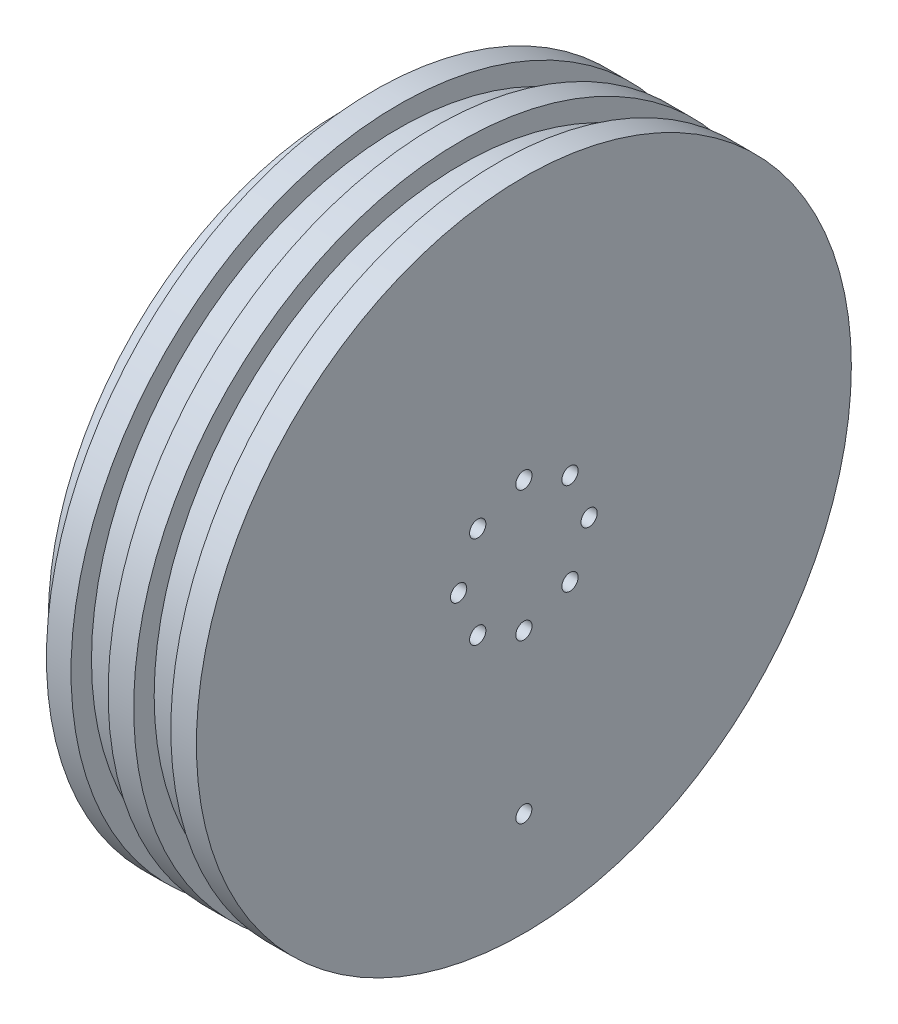
from build123d import *

# Parameters (mm, degrees)
CIRPATTERN2_COUNT              = 3
F_50_0_07_DIAMETER_HOLE1_D     = 1.778
F_50_0_07_DIAMETER_HOLE1_DEPTH = 11.938
F_50_0_07_DIAMETER_HOLE1_TIP   = 0.53416509
SKETCH60_R                     = 4.7625
BOSS_EXTRUDE4_DEPTH            = 5.461
CUT_EXTRUDE1_REACH             = 51.399
SKETCH54_R                     = 0.80645
F_1_16_0_0625_DIAMETER_HOLE1_D = 1.5875
Q_0_332_DIAMETER_HOLE2_D       = 8.4328
Q_0_332_DIAMETER_HOLE2_DEPTH   = 8.89
Q_0_332_DIAMETER_HOLE2_TIP     = 2.533468714


with BuildPart() as part:
    # Sketch1 → Revolve1 (revolve)
    with BuildSketch(Plane.XY, mode=Mode.PRIVATE) as revolve1_sk:
        Polygon((-12.599, 0), (0, 0), (0, 32.512), (-2.54, 32.512), (-2.54, 30.48), (-6.223, 30.48), (-6.223, 32.512), (-8.763, 32.512), (-8.763, 30.48), (-12.446, 30.48), (-12.446, 32.512), (-14.885, 32.512), (-14.885, 29.1592), (-18.06, 29.1592), (-18.06, 4.7625), (-12.599, 4.7625), align=None)
    revolve(revolve1_sk.sketch.rotate(Axis((17.779879847, 0, 0), (-1, 0, 0)), 90), axis=Axis((17.779879847, 0, 0), (-1, 0, 0)))

    # Sketch24 → #20 (0.161) Diameter Hole1 (revolve, cut)
    with BuildSketch(Plane(origin=(-18.06, 20.6375, 0), x_dir=(0, 0, 1), z_dir=(0, 1, 0))):
        Polygon((0, 0), (0, 10.880579708), (2.0447, 9.652), (2.0447, 0), align=None)
    f_20_0_161_diameter_hole1 = revolve(axis=Axis((-24.41, 20.6375, 0), (1, 0, 0)), mode=Mode.SUBTRACT)

    # CirPattern2: #20 (0.161) Diameter Hole1 ×3 about axis
    cirpattern2_axis = Axis((0, 0, 0), (1, 0, 0))
    for i in range(1, CIRPATTERN2_COUNT):
        add(f_20_0_161_diameter_hole1.rotate(cirpattern2_axis, i * 360 / CIRPATTERN2_COUNT), mode=Mode.SUBTRACT)

    # #50 (0.07) Diameter Hole1
    with Locations(Plane.ZY.offset(18.06)):
        with Locations((17.872599271, 10.31875)):
            Hole(F_50_0_07_DIAMETER_HOLE1_D / 2, depth=F_50_0_07_DIAMETER_HOLE1_DEPTH)
            with Locations((0, 0, -(F_50_0_07_DIAMETER_HOLE1_DEPTH + F_50_0_07_DIAMETER_HOLE1_TIP / 2))):  # 118° drill point
                Cone(0, F_50_0_07_DIAMETER_HOLE1_D / 2, F_50_0_07_DIAMETER_HOLE1_TIP, mode=Mode.SUBTRACT)

    # Sketch60 → Boss-Extrude4 (add)
    with BuildSketch(Plane.ZY.offset(12.599)):
        Circle(SKETCH60_R)
    extrude(amount=BOSS_EXTRUDE4_DEPTH)

    # Sketch54 → Cut-Extrude1 (cut, up to next)
    with BuildSketch(Plane(origin=(0, 0, 0), x_dir=(0, 0, -1), z_dir=(1, 0, 0)), mode=Mode.PRIVATE) as cut_extrude1_sk1:
        with Locations((0, 6.477)):
            Circle(SKETCH54_R)
    cut_extrude1_tool1 = extrude(cut_extrude1_sk1.sketch, amount=-CUT_EXTRUDE1_REACH, mode=Mode.PRIVATE) & part.part
    # Sketch54 → Cut-Extrude1 (cut, up to next)
    with BuildSketch(Plane(origin=(0, 0, 0), x_dir=(0, 0, -1), z_dir=(1, 0, 0)), mode=Mode.PRIVATE) as cut_extrude1_sk2:
        with Locations((4.579930622, 4.579930622)):
            Circle(SKETCH54_R)
    cut_extrude1_tool2 = extrude(cut_extrude1_sk2.sketch, amount=-CUT_EXTRUDE1_REACH, mode=Mode.PRIVATE) & part.part
    # Sketch54 → Cut-Extrude1 (cut, up to next)
    with BuildSketch(Plane(origin=(0, 0, 0), x_dir=(0, 0, -1), z_dir=(1, 0, 0)), mode=Mode.PRIVATE) as cut_extrude1_sk3:
        with Locations((6.477, 0)):
            Circle(SKETCH54_R)
    cut_extrude1_tool3 = extrude(cut_extrude1_sk3.sketch, amount=-CUT_EXTRUDE1_REACH, mode=Mode.PRIVATE) & part.part
    # Sketch54 → Cut-Extrude1 (cut, up to next)
    with BuildSketch(Plane(origin=(0, 0, 0), x_dir=(0, 0, -1), z_dir=(1, 0, 0)), mode=Mode.PRIVATE) as cut_extrude1_sk4:
        with Locations((4.579930622, -4.579930622)):
            Circle(SKETCH54_R)
    cut_extrude1_tool4 = extrude(cut_extrude1_sk4.sketch, amount=-CUT_EXTRUDE1_REACH, mode=Mode.PRIVATE) & part.part
    # Sketch54 → Cut-Extrude1 (cut, up to next)
    with BuildSketch(Plane(origin=(0, 0, 0), x_dir=(0, 0, -1), z_dir=(1, 0, 0)), mode=Mode.PRIVATE) as cut_extrude1_sk5:
        with Locations((0, -6.477)):
            Circle(SKETCH54_R)
    cut_extrude1_tool5 = extrude(cut_extrude1_sk5.sketch, amount=-CUT_EXTRUDE1_REACH, mode=Mode.PRIVATE) & part.part
    # Sketch54 → Cut-Extrude1 (cut, up to next)
    with BuildSketch(Plane(origin=(0, 0, 0), x_dir=(0, 0, -1), z_dir=(1, 0, 0)), mode=Mode.PRIVATE) as cut_extrude1_sk6:
        with Locations((-4.579930622, -4.579930622)):
            Circle(SKETCH54_R)
    cut_extrude1_tool6 = extrude(cut_extrude1_sk6.sketch, amount=-CUT_EXTRUDE1_REACH, mode=Mode.PRIVATE) & part.part
    # Sketch54 → Cut-Extrude1 (cut, up to next)
    with BuildSketch(Plane(origin=(0, 0, 0), x_dir=(0, 0, -1), z_dir=(1, 0, 0)), mode=Mode.PRIVATE) as cut_extrude1_sk7:
        with Locations((-6.477, 0)):
            Circle(SKETCH54_R)
    cut_extrude1_tool7 = extrude(cut_extrude1_sk7.sketch, amount=-CUT_EXTRUDE1_REACH, mode=Mode.PRIVATE) & part.part
    # Sketch54 → Cut-Extrude1 (cut, up to next)
    with BuildSketch(Plane(origin=(0, 0, 0), x_dir=(0, 0, -1), z_dir=(1, 0, 0)), mode=Mode.PRIVATE) as cut_extrude1_sk8:
        with Locations((-4.579930622, 4.579930622)):
            Circle(SKETCH54_R)
    cut_extrude1_tool8 = extrude(cut_extrude1_sk8.sketch, amount=-CUT_EXTRUDE1_REACH, mode=Mode.PRIVATE) & part.part
    add(cut_extrude1_tool1.solids().sort_by_distance((0, 6.477, 0))[0], mode=Mode.SUBTRACT)
    add(cut_extrude1_tool2.solids().sort_by_distance((0, 4.579931, -4.579931))[0], mode=Mode.SUBTRACT)
    add(cut_extrude1_tool3.solids().sort_by_distance((0, 0, -6.477))[0], mode=Mode.SUBTRACT)
    add(cut_extrude1_tool4.solids().sort_by_distance((0, -4.579931, -4.579931))[0], mode=Mode.SUBTRACT)
    add(cut_extrude1_tool5.solids().sort_by_distance((0, -6.477, 0))[0], mode=Mode.SUBTRACT)
    add(cut_extrude1_tool6.solids().sort_by_distance((0, -4.579931, 4.579931))[0], mode=Mode.SUBTRACT)
    add(cut_extrude1_tool7.solids().sort_by_distance((0, 0, 6.477))[0], mode=Mode.SUBTRACT)
    add(cut_extrude1_tool8.solids().sort_by_distance((0, 4.579931, 4.579931))[0], mode=Mode.SUBTRACT)

    # 1/16 (0.0625) Diameter Hole1 (through all)
    with Locations(Plane(origin=(0, -22.225, 0), x_dir=(0, 0, 1), z_dir=(1, 0, 0))):
        with Locations((0, 0)):
            Hole(F_1_16_0_0625_DIAMETER_HOLE1_D / 2)

    # Q (0.332) Diameter Hole2
    with Locations(Plane(origin=(-18.06, -22.225, 0), x_dir=(0, 0, -1), z_dir=(-1, 0, 0))):
        with Locations((0, 0)):
            Hole(Q_0_332_DIAMETER_HOLE2_D / 2, depth=Q_0_332_DIAMETER_HOLE2_DEPTH)
            with Locations((0, 0, -(Q_0_332_DIAMETER_HOLE2_DEPTH + Q_0_332_DIAMETER_HOLE2_TIP / 2))):  # 118° drill point
                Cone(0, Q_0_332_DIAMETER_HOLE2_D / 2, Q_0_332_DIAMETER_HOLE2_TIP, mode=Mode.SUBTRACT)


solid = part.part
